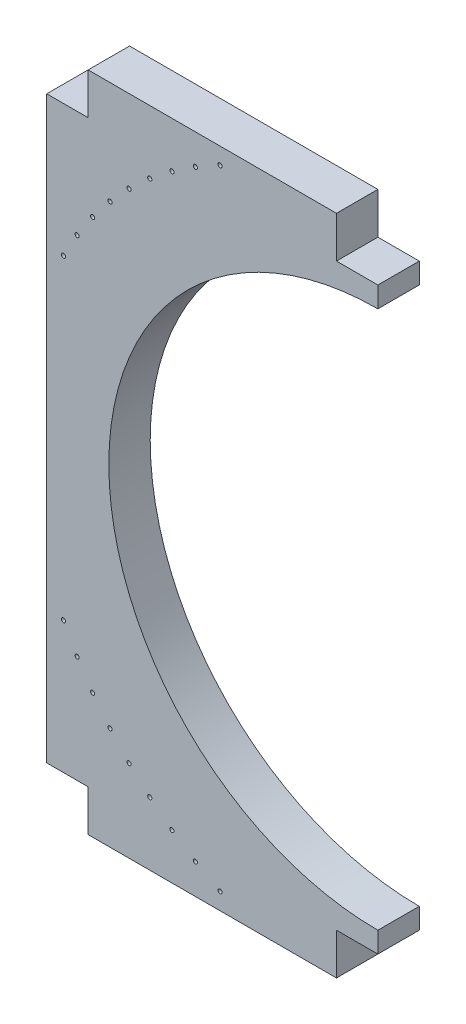
from build123d import *

# Parameters (mm, degrees)
ESQUISSE1_R             = 0.25
BOSS_EXTRU_1_DEPTH      = 5
ESQUISSE2_W             = 5
ESQUISSE2_H             = 5
ENL_V_MAT_EXTRU_1_DEPTH = 5


with BuildPart() as part:
    # Esquisse1 → Boss.-Extru.1 (new body)
    with BuildSketch(Plane.XY):
        with BuildLine():
            Line((0, 80), (40, 80))
            Line((40, 80), (40, 72.5))
            ThreePointArc((40, 72.5), (7.5, 40), (40, 7.5))
            Line((40, 7.5), (40, 0))
            Line((40, 0), (0, 0))
            Line((0, 0), (0, 80))
        make_face()
        with Locations((2.018546053, 59.069849399)):
            Circle(ESQUISSE1_R, mode=Mode.SUBTRACT)
        with Locations((7.641889366, 67.553632723)):
            Circle(ESQUISSE1_R, mode=Mode.SUBTRACT)
        with Locations((9.9479618, 70.0520382)):
            Circle(ESQUISSE1_R, mode=Mode.SUBTRACT)
        with Locations((3.664453699, 62.04491041)):
            Circle(ESQUISSE1_R, mode=Mode.SUBTRACT)
        with Locations((5.542908841, 64.878883995)):
            Circle(ESQUISSE1_R, mode=Mode.SUBTRACT)
        with Locations(Location((20.930150601, 77.981453947, 0), (0, 0, 180))):
            Circle(ESQUISSE1_R, mode=Mode.SUBTRACT)
        with Locations(Location((17.95508959, 76.335546301, 0), (0, 0, 180))):
            Circle(ESQUISSE1_R, mode=Mode.SUBTRACT)
        with Locations(Location((15.121116005, 74.457091159, 0), (0, 0, 180))):
            Circle(ESQUISSE1_R, mode=Mode.SUBTRACT)
        with Locations(Location((12.446367277, 72.358110634, 0), (0, 0, 180))):
            Circle(ESQUISSE1_R, mode=Mode.SUBTRACT)
        with Locations((12.446367277, 7.641889366)):
            Circle(ESQUISSE1_R, mode=Mode.SUBTRACT)
        with Locations((15.121116005, 5.542908841)):
            Circle(ESQUISSE1_R, mode=Mode.SUBTRACT)
        with Locations((17.95508959, 3.664453699)):
            Circle(ESQUISSE1_R, mode=Mode.SUBTRACT)
        with Locations((20.930150601, 2.018546053)):
            Circle(ESQUISSE1_R, mode=Mode.SUBTRACT)
        with Locations(Location((5.542908841, 15.121116005, 0), (0, 0, 180))):
            Circle(ESQUISSE1_R, mode=Mode.SUBTRACT)
        with Locations(Location((3.664453699, 17.95508959, 0), (0, 0, 180))):
            Circle(ESQUISSE1_R, mode=Mode.SUBTRACT)
        with Locations(Location((9.9479618, 9.9479618, 0), (0, 0, 180))):
            Circle(ESQUISSE1_R, mode=Mode.SUBTRACT)
        with Locations(Location((7.641889366, 12.446367277, 0), (0, 0, 180))):
            Circle(ESQUISSE1_R, mode=Mode.SUBTRACT)
        with Locations(Location((2.018546053, 20.930150601, 0), (0, 0, 180))):
            Circle(ESQUISSE1_R, mode=Mode.SUBTRACT)
    extrude(amount=BOSS_EXTRU_1_DEPTH)

    # Esquisse2 → Enlèv. mat.-Extru.1 (cut)
    with BuildSketch(Plane.XY.offset(5)):
        with Locations((2.5, 2.5)):
            Rectangle(ESQUISSE2_W, ESQUISSE2_H)
        with Locations((37.5, 2.5)):
            Rectangle(ESQUISSE2_W, ESQUISSE2_H)
        with Locations((37.5, 77.5)):
            Rectangle(ESQUISSE2_W, ESQUISSE2_H)
        with Locations((2.5, 77.5)):
            Rectangle(ESQUISSE2_W, ESQUISSE2_H)
    extrude(amount=-ENL_V_MAT_EXTRU_1_DEPTH, mode=Mode.SUBTRACT)


solid = part.part
